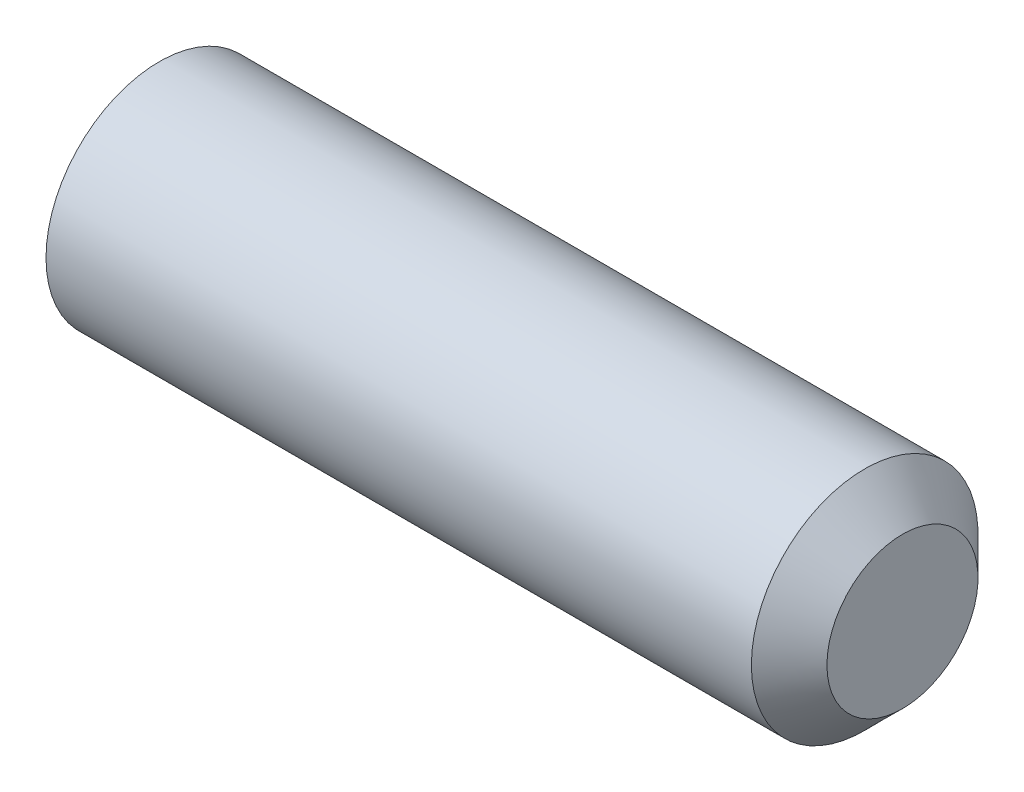
from build123d import *

# Parameters (mm, degrees)
HEX_2_DEPTH = 2.1


with BuildPart() as part:
    # BodySke → BaseBody (revolve)
    with BuildSketch(Plane.XY, mode=Mode.PRIVATE) as basebody_sk:
        Polygon((0, 0), (0, 1.2195), (0.161946751, 1.5), (9.5, 1.5), (10, 1), (10, 0), align=None)
    revolve(basebody_sk.sketch.rotate(Axis((-12.7, 0, 0), (1, 0, 0)), 90), axis=Axis((-12.7, 0, 0), (1, 0, 0)))

    # Sketch2 → Hex 2 (cut)
    with BuildSketch(Plane.ZY):
        Polygon((0.433012702, 0.75), (-0.433012702, 0.75), (-0.866025404, 0), (-0.433012702, -0.75), (0.433012702, -0.75), (0.866025404, 0), align=None)
    extrude(amount=-HEX_2_DEPTH, mode=Mode.SUBTRACT)


solid = part.part
